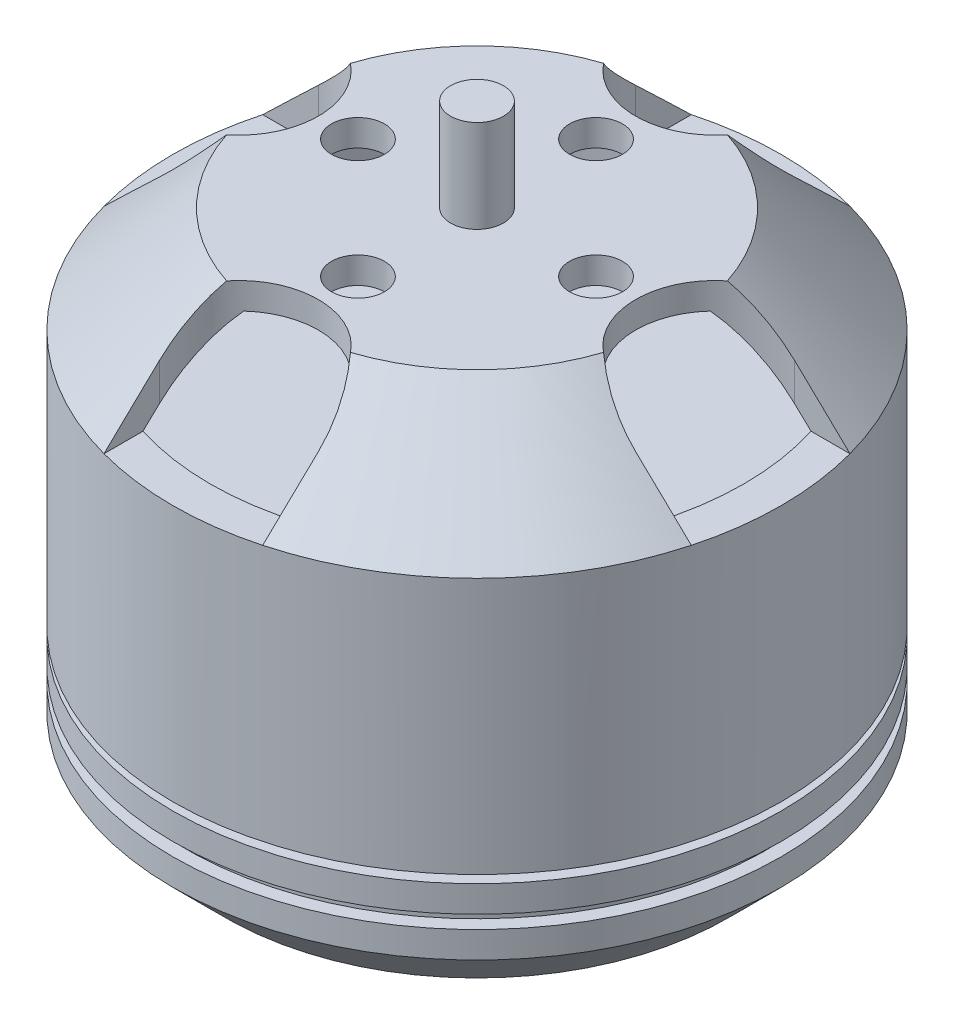
from build123d import *

# Parameters (mm, degrees)
SKETCH3_R          = 1
CUT_EXTRUDE1_DEPTH = 4
SKETCH5_R          = 1
CUT_EXTRUDE2_DEPTH = 3


with BuildPart() as part:
    # Sketch2 → Revolve2 (revolve)
    with BuildSketch(Plane.XY, mode=Mode.PRIVATE) as revolve2_sk:
        Polygon((0, 0), (0, 22), (1, 22), (1, 18.5), (7.5, 18.5), (11.5, 14.5), (11.5, 4.8), (9.5, 4.8), (9.5, 4.5), (11.5, 4.5), (11.5, 3.5), (11, 3.5), (11, 3), (11.5, 3), (11.5, 2), (9.5, 0), (2, 0), (2, -1.8), (0, -1.8), align=None)
        Polygon((1, 16.5), (1, 10.79), (10.5, 10.79), (10.5, 14.085786438), (7.085786438, 17.5), (2, 17.5), (2, 16.5), align=None, mode=Mode.SUBTRACT)
    revolve(revolve2_sk.sketch.rotate(Axis((0, 0, 0), (0, 1, 0)), 90), axis=Axis((0, 0, 0), (0, 1, 0)))

    # Sketch3 → Cut-Extrude1 (cut)
    with BuildSketch(Plane(origin=(0, 18.5, 0), x_dir=(1, 0, 0), z_dir=(0, 1, 0))):
        with Locations(Location((0, 4.5, 0), (0, 0, 270))):
            Circle(SKETCH3_R)
        with Locations(Location((4.5, 0, 0), (0, 0, 270))):
            Circle(SKETCH3_R)
        with Locations(Location((0, -4.5, 0), (0, 0, 270))):
            Circle(SKETCH3_R)
        with Locations(Location((-4.5, 0, 0), (0, 0, 270))):
            Circle(SKETCH3_R)
        with BuildLine():
            Line((3, 9), (3, 18.27))
            Line((3, 18.27), (-3, 18.27))
            Line((-3, 18.27), (-3, 9))
            ThreePointArc((-3, 9), (0, 6), (3, 9))
        make_face()
        with BuildLine():
            Line((9, -3), (18.27, -3))
            Line((18.27, -3), (18.27, 3))
            Line((18.27, 3), (9, 3))
            ThreePointArc((9, 3), (6, 0), (9, -3))
        make_face()
        with BuildLine():
            Line((-3, -9), (-3, -18.27))
            Line((-3, -18.27), (3, -18.27))
            Line((3, -18.27), (3, -9))
            ThreePointArc((3, -9), (0, -6), (-3, -9))
        make_face()
        with BuildLine():
            Line((-9, 3), (-18.27, 3))
            Line((-18.27, 3), (-18.27, -3))
            Line((-18.27, -3), (-9, -3))
            ThreePointArc((-9, -3), (-6, 0), (-9, 3))
        make_face()
    extrude(amount=-CUT_EXTRUDE1_DEPTH, mode=Mode.SUBTRACT)

    # Sketch5 → Cut-Extrude2 (cut)
    with BuildSketch(Plane.XZ):
        with Locations(Location((0, 6, 0), (0, 0, 270))):
            Circle(SKETCH5_R)
        with Locations(Location((6, 0, 0), (0, 0, 270))):
            Circle(SKETCH5_R)
        with Locations(Location((0, -6, 0), (0, 0, 270))):
            Circle(SKETCH5_R)
        with Locations(Location((-6, 0, 0), (0, 0, 270))):
            Circle(SKETCH5_R)
    extrude(amount=-CUT_EXTRUDE2_DEPTH, mode=Mode.SUBTRACT)


solid = part.part
